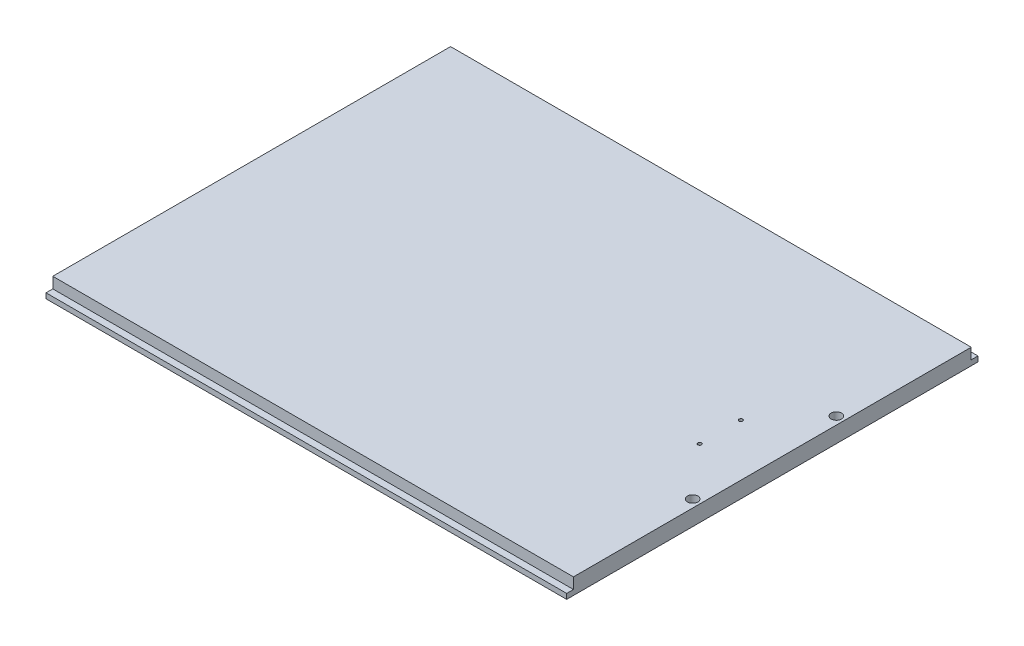
from build123d import *

# Parameters (mm, degrees)
SKETCH_1_W          = 76.4
SKETCH_1_H          = 2.1
SKETCH_1_W_2        = 79
SKETCH_1_H_2        = 1
EXTRUDE_1_DEPTH     = 100
SKETCH_2_R          = 0.35
CUT_EXTRUDE_1_DEPTH = 3
SKETCH_4_R          = 0.6
CUT_EXTRUDE_2_DEPTH = 108.563283698
SKETCH_4_3_R        = 1
CUT_EXTRUDE_3_DEPTH = 1.5
SKETCH_5_R          = 0.35
CUT_EXTRUDE_4_DEPTH = 108.563283698


with BuildPart() as part:
    # 草图1 → 凸台-拉伸1 (new body)
    with BuildSketch(Plane(origin=(0, 0, 0), x_dir=(0, 0, -1), z_dir=(1, 0, 0))):
        with Locations((0, -1.05)):
            Rectangle(SKETCH_1_W, SKETCH_1_H)
        with Locations((0, -2.6)):
            Rectangle(SKETCH_1_W_2, SKETCH_1_H_2)
    extrude(amount=EXTRUDE_1_DEPTH)

    # 草图2 → 切除-拉伸1 (cut)
    with BuildSketch(Plane.ZY):
        with Locations((-13.8, -1.5)):
            Circle(SKETCH_2_R)
        with Locations((13.8, -1.5)):
            Circle(SKETCH_2_R)
    extrude(amount=-CUT_EXTRUDE_1_DEPTH, mode=Mode.SUBTRACT)

    # 草图4 → 切除-拉伸2 (cut, through all)
    with BuildSketch(Plane(origin=(0, 0, 0), x_dir=(1, 0, 0), z_dir=(0, 1, 0))):
        with Locations((98.5, -13.8)):
            Circle(SKETCH_4_R)
        with Locations((98.5, 13.8)):
            Circle(SKETCH_4_R)
    extrude(amount=-CUT_EXTRUDE_2_DEPTH, mode=Mode.SUBTRACT)

    # 草图4<3> → 切除-拉伸3 (cut)
    with BuildSketch(Plane(origin=(0, 0, 0), x_dir=(1, 0, 0), z_dir=(0, 1, 0))):
        with Locations((98.5, -13.8)):
            Circle(SKETCH_4_3_R)
        with Locations((98.5, 13.8)):
            Circle(SKETCH_4_3_R)
    extrude(amount=-CUT_EXTRUDE_3_DEPTH, mode=Mode.SUBTRACT)

    # 草图5 → 切除-拉伸4 (cut, through all)
    with BuildSketch(Plane(origin=(0, 0, 0), x_dir=(1, 0, 0), z_dir=(0, 1, 0))):
        with Locations((90, 3.95)):
            Circle(SKETCH_5_R)
        with Locations((90, -3.95)):
            Circle(SKETCH_5_R)
    extrude(amount=-CUT_EXTRUDE_4_DEPTH, mode=Mode.SUBTRACT)


solid = part.part
